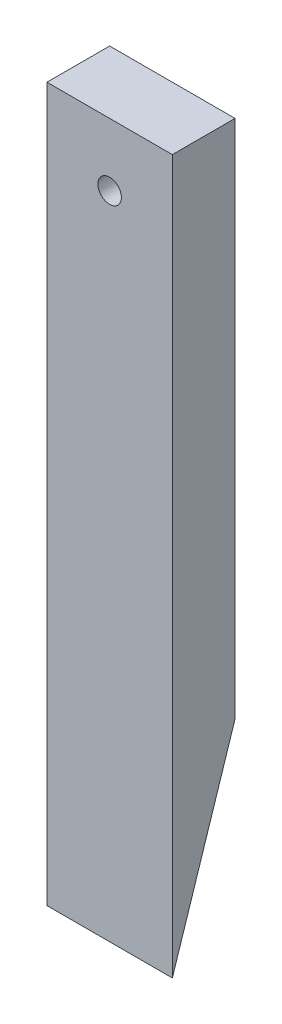
from build123d import *

# Parameters (mm, degrees)
ESQUISSE1_W             = 48
ESQUISSE1_H             = 273
BOSS_EXTRU_1_DEPTH      = 24
ENL_V_MAT_EXTRU_1_DEPTH = 147.670549191
ESQUISSE5_R             = 4.5
ENL_V_MAT_EXTRU_2_DEPTH = 141.656496473


with BuildPart() as part:
    # Esquisse1 → Boss.-Extru.1 (new body)
    with BuildSketch(Plane.XY):
        Rectangle(ESQUISSE1_W, ESQUISSE1_H)
    extrude(amount=BOSS_EXTRU_1_DEPTH)

    # Esquisse4 → Enlèv. mat.-Extru.1 (cut, through all)
    with BuildSketch(Plane(origin=(24, 0, 0), x_dir=(0, 0, -1), z_dir=(1, 0, 0))):
        Polygon((-24, -136.5), (0, -62.635595108), (0, -136.5), align=None)
    extrude(amount=-ENL_V_MAT_EXTRU_1_DEPTH, mode=Mode.SUBTRACT)

    # Esquisse5 → Enlèv. mat.-Extru.2 (cut, through all)
    with BuildSketch(Plane.XY.offset(24)):
        with Locations((0, 112.5)):
            Circle(ESQUISSE5_R)
    extrude(amount=-ENL_V_MAT_EXTRU_2_DEPTH, mode=Mode.SUBTRACT)


solid = part.part
